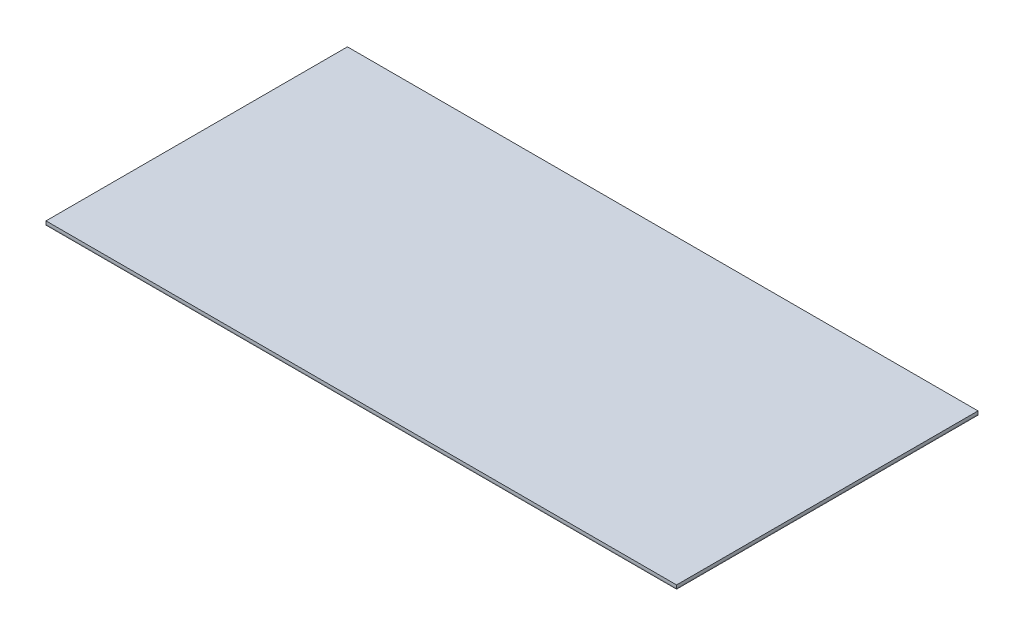
from build123d import *

# Parameters (mm, degrees)
CROQUIS1_W     = 2050
CROQUIS1_H     = 980
EXTRUIR1_DEPTH = 10
CROQUIS2_W     = 2050
CROQUIS2_H     = 980
EXTRUIR2_DEPTH = 2


with BuildPart() as part:
    # Croquis1 → Extruir1 (new body)
    with BuildSketch(Plane(origin=(0, 0, 0), x_dir=(1, 0, 0), z_dir=(0, 1, 0))):
        Rectangle(CROQUIS1_W, CROQUIS1_H)
    extrude(amount=EXTRUIR1_DEPTH)


with BuildPart() as body_2:
    # Croquis2 → Extruir2 (new body)
    with BuildSketch(Plane.XZ):
        Rectangle(CROQUIS2_W, CROQUIS2_H)
    extrude(amount=EXTRUIR2_DEPTH)


solid = Compound([part.part, body_2.part])
